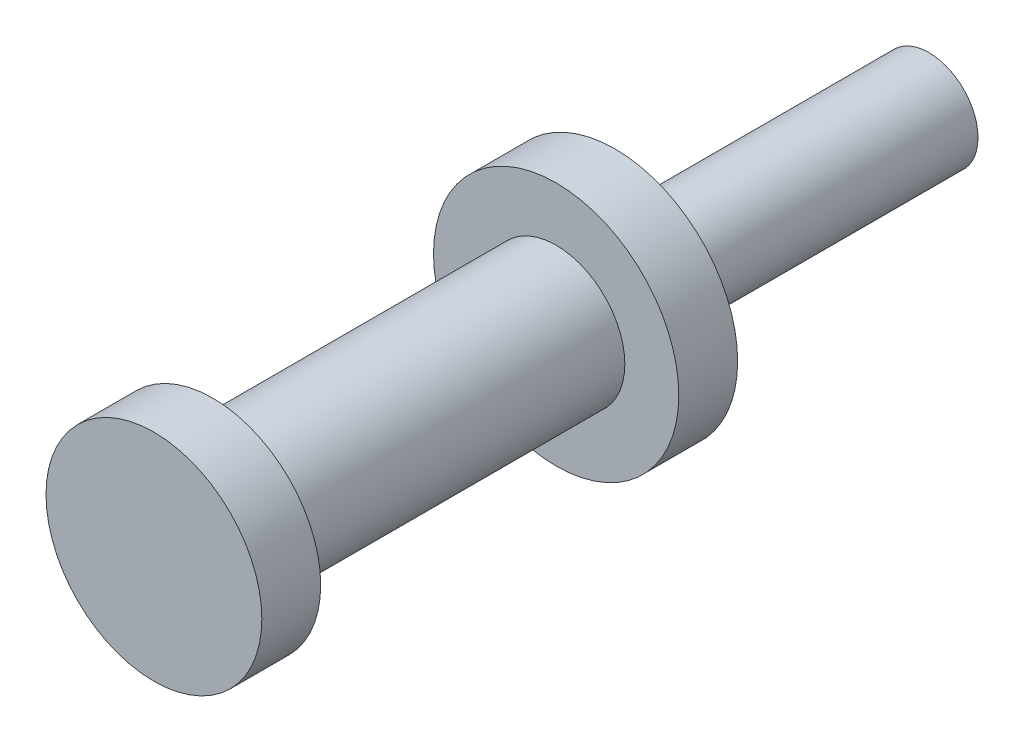
from build123d import *


with BuildPart() as part:
    # Sketch1 → Revolve1 (revolve)
    with BuildSketch(Plane(origin=(0, 0, 0), x_dir=(0, 0, -1), z_dir=(1, 0, 0)), mode=Mode.PRIVATE) as revolve1_sk:
        Polygon((0, 0), (0.6, 0), (0.6, -0.4), (4.1, -0.4), (4.1, 0.15), (4.7, 0.15), (4.7, -0.6), (7.9, -0.6), (7.9, -1.1), (0, -1.1), align=None)
    revolve(revolve1_sk.sketch.rotate(Axis((0, -1.1, 0), (0, 0, -1)), 90), axis=Axis((0, -1.1, 0), (0, 0, -1)))


solid = part.part
